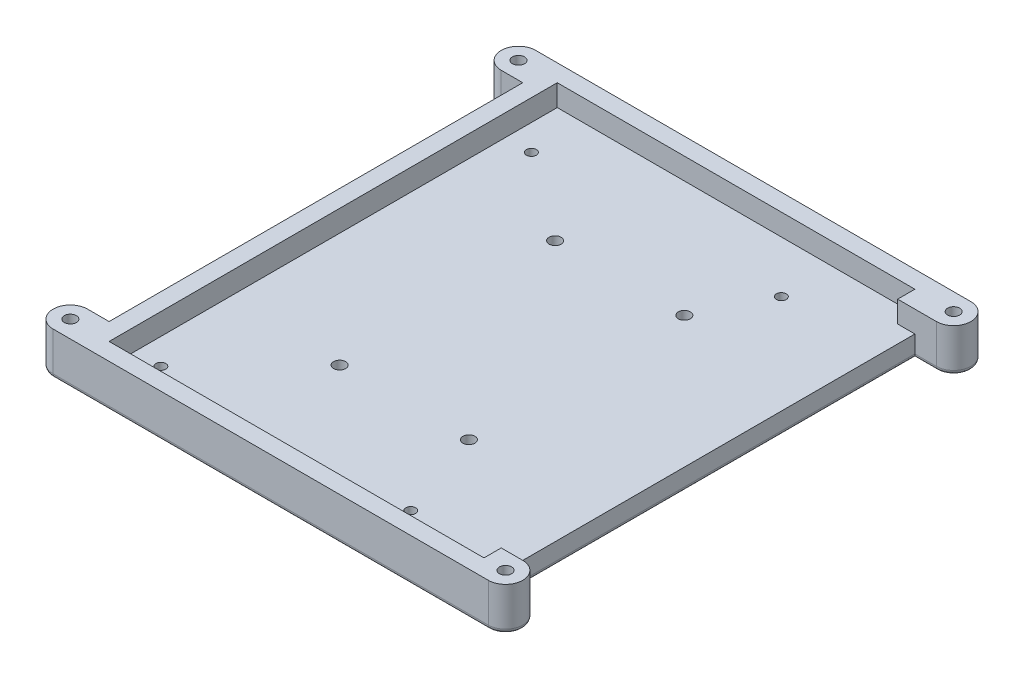
from build123d import *

# Parameters (mm, degrees)
SKETCH1_W                         = 91
SKETCH1_H                         = 112
SKETCH1_R                         = 1.15
BASE_DEPTH                        = 10
SKETCH2_W                         = 83
SKETCH2_H                         = 104
MODULE_CUTOUT_DEPTH               = 5
SKETCH3_R                         = 1.4
CASE_ASSEMBLY_HOLES_DEPTH         = 10
SKETCH5_W                         = 4
SKETCH5_H                         = 100
PORTS_SIDE_RECESS_DEPTH           = 5
BASKET_CLAMP_MOUNTING_HOLES_REACH = 80.78
SKETCH4_R                         = 1.4
F_1MM_EDGE_FILLETS_R              = 1


with BuildPart() as part:
    # Sketch1 → Base (new body)
    with BuildSketch(Plane(origin=(0, 0, 0), x_dir=(1, 0, 0), z_dir=(0, 1, 0))):
        Rectangle(SKETCH1_W, SKETCH1_H)
        with Locations(Location((-35.5, -46, 0), (0, 0, 270))):
            Circle(SKETCH1_R, mode=Mode.SUBTRACT)
        with Locations(Location((22.5, -46, 0), (0, 0, 270))):
            Circle(SKETCH1_R, mode=Mode.SUBTRACT)
        with Locations(Location((22.5, 40, 0), (0, 0, 270))):
            Circle(SKETCH1_R, mode=Mode.SUBTRACT)
        with Locations(Location((-35.5, 40, 0), (0, 0, 270))):
            Circle(SKETCH1_R, mode=Mode.SUBTRACT)
    extrude(amount=BASE_DEPTH)

    # Sketch2 → Module Cutout (cut)
    with BuildSketch(Plane(origin=(0, 10, 0), x_dir=(1, 0, 0), z_dir=(0, 1, 0))):
        Rectangle(SKETCH2_W, SKETCH2_H)
    extrude(amount=-MODULE_CUTOUT_DEPTH, mode=Mode.SUBTRACT)

    # Sketch3 → Case Assembly Holes (add)
    # profile 1 of 4: a face of its own
    with BuildSketch(Plane(origin=(0, 10, 0), x_dir=(1, 0, 0), z_dir=(0, 1, 0))):
        with BuildLine():
            Line((-45.5, 56), (-50.5, 56))
            ThreePointArc((-50.5, 56), (-54.5, 52), (-50.5, 48))
            Line((-50.5, 48), (-45.5, 48))
            Line((-45.5, 48), (-45.5, 56))
        make_face()
        with Locations(Location((-50.5, 52, 0), (0, 0, 270))):
            Circle(SKETCH3_R, mode=Mode.SUBTRACT)
    # profile 2 of 4: a face of its own
    with BuildSketch(Plane(origin=(0, 10, 0), x_dir=(1, 0, 0), z_dir=(0, 1, 0))):
        with BuildLine():
            Line((45.5, 48), (50.5, 48))
            ThreePointArc((50.5, 48), (54.5, 52), (50.5, 56))
            Line((50.5, 56), (45.5, 56))
            Line((45.5, 56), (45.5, 48))
        make_face()
        with Locations(Location((50.5, 52, 0), (0, 0, 270))):
            Circle(SKETCH3_R, mode=Mode.SUBTRACT)
    # profile 3 of 4: a face of its own
    with BuildSketch(Plane(origin=(0, 10, 0), x_dir=(1, 0, 0), z_dir=(0, 1, 0))):
        with BuildLine():
            Line((45.5, -56), (50.5, -56))
            ThreePointArc((50.5, -56), (54.5, -52), (50.5, -48))
            Line((50.5, -48), (45.5, -48))
            Line((45.5, -48), (45.5, -56))
        make_face()
        with Locations(Location((50.5, -52, 0), (0, 0, 270))):
            Circle(SKETCH3_R, mode=Mode.SUBTRACT)
    # profile 4 of 4: a face of its own
    with BuildSketch(Plane(origin=(0, 10, 0), x_dir=(1, 0, 0), z_dir=(0, 1, 0))):
        with BuildLine():
            Line((-45.5, -48), (-50.5, -48))
            ThreePointArc((-50.5, -48), (-54.5, -52), (-50.5, -56))
            Line((-50.5, -56), (-45.5, -56))
            Line((-45.5, -56), (-45.5, -48))
        make_face()
        with Locations(Location((-50.5, -52, 0), (0, 0, 270))):
            Circle(SKETCH3_R, mode=Mode.SUBTRACT)
    extrude(amount=-CASE_ASSEMBLY_HOLES_DEPTH)

    # Sketch5 → Ports Side Recess (cut)
    with BuildSketch(Plane(origin=(0, 10, 0), x_dir=(1, 0, 0), z_dir=(0, 1, 0))):
        with Locations((43.5, -2)):
            Rectangle(SKETCH5_W, SKETCH5_H)
    extrude(amount=-PORTS_SIDE_RECESS_DEPTH, mode=Mode.SUBTRACT)

    # Sketch4 → Basket Clamp Mounting Holes (cut, up to next)
    with BuildSketch(Plane.XZ, mode=Mode.PRIVATE) as basket_clamp_mounting_holes_sk1:
        with Locations(Location((-15, 25, 0), (0, 0, 270))):
            Circle(SKETCH4_R)
    basket_clamp_mounting_holes_tool1 = extrude(basket_clamp_mounting_holes_sk1.sketch, amount=-BASKET_CLAMP_MOUNTING_HOLES_REACH, mode=Mode.PRIVATE) & part.part
    # Sketch4 → Basket Clamp Mounting Holes (cut, up to next)
    with BuildSketch(Plane.XZ, mode=Mode.PRIVATE) as basket_clamp_mounting_holes_sk2:
        with Locations(Location((-15, -25, 0), (0, 0, 270))):
            Circle(SKETCH4_R)
    basket_clamp_mounting_holes_tool2 = extrude(basket_clamp_mounting_holes_sk2.sketch, amount=-BASKET_CLAMP_MOUNTING_HOLES_REACH, mode=Mode.PRIVATE) & part.part
    # Sketch4 → Basket Clamp Mounting Holes (cut, up to next)
    with BuildSketch(Plane.XZ, mode=Mode.PRIVATE) as basket_clamp_mounting_holes_sk3:
        with Locations(Location((15, -25, 0), (0, 0, 270))):
            Circle(SKETCH4_R)
    basket_clamp_mounting_holes_tool3 = extrude(basket_clamp_mounting_holes_sk3.sketch, amount=-BASKET_CLAMP_MOUNTING_HOLES_REACH, mode=Mode.PRIVATE) & part.part
    # Sketch4 → Basket Clamp Mounting Holes (cut, up to next)
    with BuildSketch(Plane.XZ, mode=Mode.PRIVATE) as basket_clamp_mounting_holes_sk4:
        with Locations(Location((15, 25, 0), (0, 0, 270))):
            Circle(SKETCH4_R)
    basket_clamp_mounting_holes_tool4 = extrude(basket_clamp_mounting_holes_sk4.sketch, amount=-BASKET_CLAMP_MOUNTING_HOLES_REACH, mode=Mode.PRIVATE) & part.part
    add(basket_clamp_mounting_holes_tool1.solids().sort_by_distance((-15, 0, 25))[0], mode=Mode.SUBTRACT)
    add(basket_clamp_mounting_holes_tool2.solids().sort_by_distance((-15, 0, -25))[0], mode=Mode.SUBTRACT)
    add(basket_clamp_mounting_holes_tool3.solids().sort_by_distance((15, 0, -25))[0], mode=Mode.SUBTRACT)
    add(basket_clamp_mounting_holes_tool4.solids().sort_by_distance((15, 0, 25))[0], mode=Mode.SUBTRACT)

    # 1mm Edge Fillets
    f_1mm_edge_fillets_edges = [part.edges().sort_by_distance(p)[0] for p in [
        (0, 0, -56),
        (-45.5, 0, 0),
        (-48, 0, -48),
        (-54.5, 0, -52),
        (0, 0, 56),
        (54.5, 0, -52),
        (48, 0, -48),
        (45.5, 0, 0),
        (54.5, 0, 52),
        (48, 0, 48),
        (-54.5, 0, 52),
        (-48, 0, 48),
    ]]
    fillet(f_1mm_edge_fillets_edges, radius=F_1MM_EDGE_FILLETS_R)


solid = part.part
